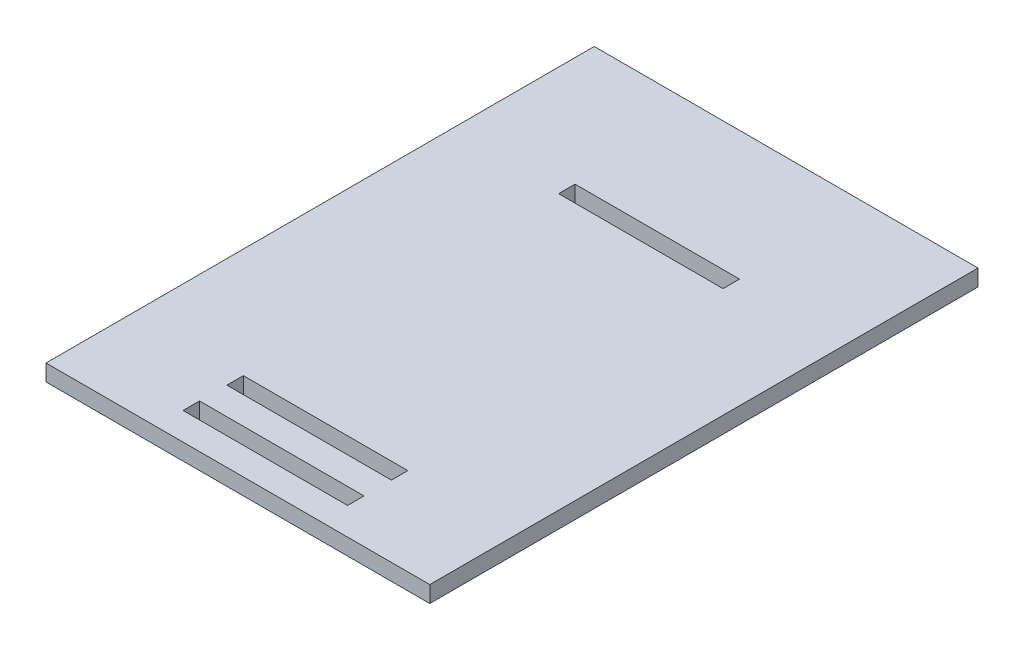
from build123d import *

# Parameters (mm, degrees)
SKETCH1_W           = 70
SKETCH1_H           = 100
BOSS_EXTRUDE1_DEPTH = 3
SKETCH2_W           = 30
SKETCH2_H           = 3
CUT_EXTRUDE1_DEPTH  = 62.10646447


with BuildPart() as part:
    # Sketch1 → Boss-Extrude1 (new body)
    with BuildSketch(Plane(origin=(0, 0, 0), x_dir=(1, 0, 0), z_dir=(0, 1, 0))):
        Rectangle(SKETCH1_W, SKETCH1_H)
    extrude(amount=BOSS_EXTRUDE1_DEPTH)

    # Sketch2 → Cut-Extrude1 (cut, through all)
    with BuildSketch(Plane(origin=(0, 3, 0), x_dir=(1, 0, 0), z_dir=(0, 1, 0))):
        with Locations((0, -43.5)):
            Rectangle(SKETCH2_W, SKETCH2_H)
        with Locations((0, -35.5)):
            Rectangle(SKETCH2_W, SKETCH2_H)
        with Locations((0, 25)):
            Rectangle(SKETCH2_W, SKETCH2_H)
    extrude(amount=-CUT_EXTRUDE1_DEPTH, mode=Mode.SUBTRACT)


solid = part.part
